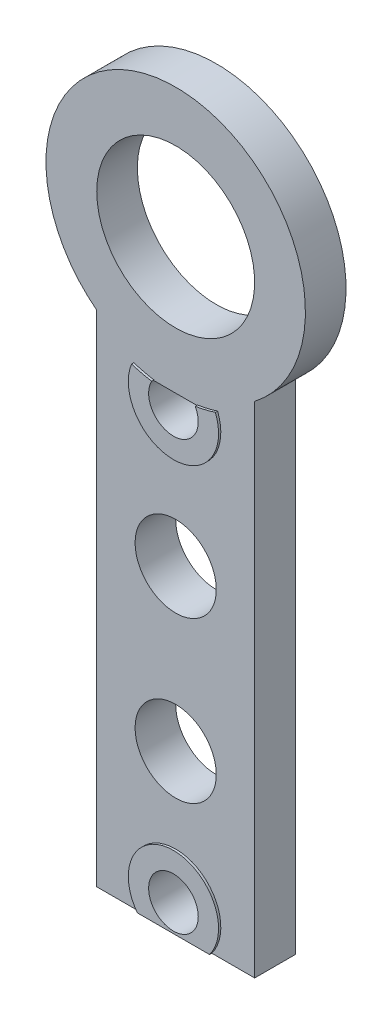
from build123d import *

# Parameters (mm, degrees)
RETAINER_PLATE_START                       = 33.1
SKETCH1_W                                  = 7
SKETCH1_H                                  = 23
RETAINER_PLATE_DEPTH                       = 1.8
RETAINER_MOUNTING_SPACERS_START            = 34.9
SKETCH2_R                                  = 2
RETAINER_MOUNTING_SPACERS_DEPTH            = 0.1
RETAINER_CLEARANCE_HOLES_START             = 32
SKETCH3_R                                  = 1.7
SKETCH3_R_2                                = 1.1
RETAINER_CLEARANCE_HOLES_DEPTH             = 6
CLEAR_END_WALL_START                       = 33
SKETCH4_W                                  = 15
SKETCH4_H                                  = 6.3
CLEAR_END_WALL_DEPTH                       = 6
THUMB_MOUNT_EXTENSION_START                = 33.1
SKETCH5_W                                  = 7
SKETCH5_H                                  = 6
THUMB_MOUNT_EXTENSION_DEPTH                = 1.8
THUMB_MOUNT_PAD_START                      = 33.1
SKETCH6_R                                  = 5.75
THUMB_MOUNT_PAD_DEPTH                      = 1.8
THUMB_CLEARANCE_D7_START                   = 32.8
SKETCH7_R                                  = 3.5
THUMB_CLEARANCE_D7_DEPTH                   = 2.5
CLEAR_LEGACY_SPACER_FROM_THUMB_BOSS_START  = 34.9
SKETCH8_R                                  = 6.05
CLEAR_LEGACY_SPACER_FROM_THUMB_BOSS_DEPTH  = 2.3
FREE_SLIDING_BUTTON_LOWER_GUIDE_D3P6_START = 33
SKETCH9_R                                  = 1.8
FREE_SLIDING_BUTTON_LOWER_GUIDE_D3P6_DEPTH = 2
CUT_EXTRUDE2_START                         = 33
SKETCH10_R                                 = 1.8
CUT_EXTRUDE2_DEPTH                         = 2


with BuildPart() as part:
    # Sketch1 → Retainer_plate (new body)
    with BuildSketch(Plane.XY.offset(RETAINER_PLATE_START)):
        with Locations((-32.018684277, -38)):
            Rectangle(SKETCH1_W, SKETCH1_H)
    extrude(amount=RETAINER_PLATE_DEPTH)

    # Sketch2 → Retainer_mounting_spacers (add)
    with BuildSketch(Plane.XY.offset(RETAINER_MOUNTING_SPACERS_START)):
        with Locations(Location((-32.018684277, -47.5, 0), (0, 0, 270))):
            Circle(SKETCH2_R)
        with Locations(Location((-32.018684277, -28.5, 0), (0, 0, 90))):
            Circle(SKETCH2_R)
    extrude(amount=RETAINER_MOUNTING_SPACERS_DEPTH)

    # Sketch3 → Retainer_clearance_holes (cut)
    with BuildSketch(Plane.XY.offset(RETAINER_CLEARANCE_HOLES_START)):
        with Locations(Location((-32.018684277, -41.745416557, 0), (0, 0, 180))):
            Circle(SKETCH3_R)
        with Locations(Location((-32.018684277, -34.643402341, 0), (0, 0, 180))):
            Circle(SKETCH3_R)
        with Locations(Location((-32.018684277, -47.5, 0), (0, 0, 180))):
            Circle(SKETCH3_R_2)
        with Locations(Location((-32.018684277, -28.5, 0), (0, 0, 180))):
            Circle(SKETCH3_R_2)
    extrude(amount=RETAINER_CLEARANCE_HOLES_DEPTH, mode=Mode.SUBTRACT)

    # Sketch4 → Clear_end_wall (cut)
    with BuildSketch(Plane.XY.offset(CLEAR_END_WALL_START)):
        with Locations((-32.5, -51.85)):
            Rectangle(SKETCH4_W, SKETCH4_H)
    extrude(amount=CLEAR_END_WALL_DEPTH, mode=Mode.SUBTRACT)

    # Sketch5 → Thumb_mount_extension (add)
    with BuildSketch(Plane.XY.offset(THUMB_MOUNT_EXTENSION_START)):
        with Locations((-32.018684277, -25)):
            Rectangle(SKETCH5_W, SKETCH5_H)
    extrude(amount=THUMB_MOUNT_EXTENSION_DEPTH)

    # Sketch6 → Thumb_mount_pad (add)
    with BuildSketch(Plane.XY.offset(THUMB_MOUNT_PAD_START)):
        with Locations((-32.018684277, -22)):
            Circle(SKETCH6_R)
    extrude(amount=THUMB_MOUNT_PAD_DEPTH)

    # Sketch7 → Thumb_clearance_D7 (cut)
    with BuildSketch(Plane.XY.offset(THUMB_CLEARANCE_D7_START)):
        with Locations(Location((-32.018684277, -22, 0), (0, 0, 180))):
            Circle(SKETCH7_R)
    extrude(amount=THUMB_CLEARANCE_D7_DEPTH, mode=Mode.SUBTRACT)

    # Sketch8 → Clear_legacy_spacer_from_thumb_boss (cut)
    with BuildSketch(Plane.XY.offset(CLEAR_LEGACY_SPACER_FROM_THUMB_BOSS_START)):
        with Locations((-32.018684277, -22)):
            Circle(SKETCH8_R)
    extrude(amount=CLEAR_LEGACY_SPACER_FROM_THUMB_BOSS_DEPTH, mode=Mode.SUBTRACT)

    # Sketch9 → Free_sliding_button_lower_guide_D3p6 (cut)
    with BuildSketch(Plane.XY.offset(FREE_SLIDING_BUTTON_LOWER_GUIDE_D3P6_START)):
        with Locations(Location((-32.018684277, -41.745416557, 0), (0, 0, 180))):
            Circle(SKETCH9_R)
    extrude(amount=FREE_SLIDING_BUTTON_LOWER_GUIDE_D3P6_DEPTH, mode=Mode.SUBTRACT)

    # Sketch10 → Cut-Extrude2 (cut)
    with BuildSketch(Plane.XY.offset(CUT_EXTRUDE2_START)):
        with Locations(Location((-32.018684277, -34.643402341, 0), (0, 0, 180))):
            Circle(SKETCH10_R)
    extrude(amount=CUT_EXTRUDE2_DEPTH, mode=Mode.SUBTRACT)


solid = part.part
